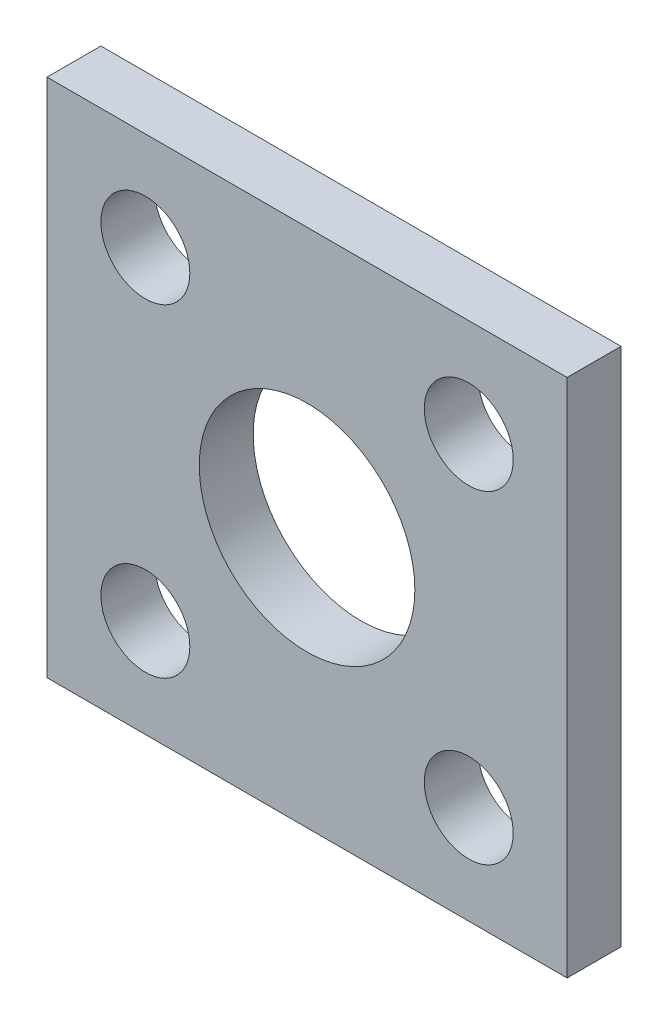
from build123d import *

# Parameters (mm, degrees)
SKETCH1_W           = 48.25
SKETCH1_H           = 48.25
SKETCH1_R           = 10
SKETCH1_R_2         = 4.125
BOSS_EXTRUDE1_DEPTH = 5


with BuildPart() as part:
    # Sketch1 → Boss-Extrude1 (new body)
    # profile 1 of 5: a face of its own
    with BuildSketch(Plane.XY):
        with Locations((24.125, 24.125)):
            Rectangle(SKETCH1_W, SKETCH1_H)
        with Locations((24.125, 24.125)):
            Circle(SKETCH1_R, mode=Mode.SUBTRACT)
        Polygon((34.895909278, 1.8), (30.666818556, 9.125), (34.895909278, 16.45), (43.354090722, 16.45), (47.583181444, 9.125), (43.354090722, 1.8), align=None, mode=Mode.SUBTRACT)
        Polygon((13.354090722, 1.8), (17.583181444, 9.125), (13.354090722, 16.45), (4.895909278, 16.45), (0.666818556, 9.125), (4.895909278, 1.8), align=None, mode=Mode.SUBTRACT)
        Polygon((34.895909278, 31.8), (43.354090722, 31.8), (47.583181444, 39.125), (43.354090722, 46.45), (34.895909278, 46.45), (30.666818556, 39.125), align=None, mode=Mode.SUBTRACT)
        Polygon((17.583181444, 39.125), (13.354090722, 31.8), (4.895909278, 31.8), (0.666818556, 39.125), (4.895909278, 46.45), (13.354090722, 46.45), align=None, mode=Mode.SUBTRACT)
    # profile 2 of 5: a face of its own
    with BuildSketch(Plane.XY):
        Polygon((30.666818556, 39.125), (34.895909278, 31.8), (43.354090722, 31.8), (47.583181444, 39.125), (43.354090722, 46.45), (34.895909278, 46.45), align=None)
        with Locations((39.125, 39.125)):
            Circle(SKETCH1_R_2, mode=Mode.SUBTRACT)
    # profile 3 of 5: a face of its own
    with BuildSketch(Plane.XY):
        Polygon((30.666818556, 9.125), (34.895909278, 16.45), (43.354090722, 16.45), (47.583181444, 9.125), (43.354090722, 1.8), (34.895909278, 1.8), align=None)
        with Locations((39.125, 9.125)):
            Circle(SKETCH1_R_2, mode=Mode.SUBTRACT)
    # profile 4 of 5: a face of its own
    with BuildSketch(Plane.XY):
        Polygon((4.895909278, 1.8), (13.354090722, 1.8), (17.583181444, 9.125), (13.354090722, 16.45), (4.895909278, 16.45), (0.666818556, 9.125), align=None)
        with Locations((9.125, 9.125)):
            Circle(SKETCH1_R_2, mode=Mode.SUBTRACT)
    # profile 5 of 5: a face of its own
    with BuildSketch(Plane.XY):
        Polygon((13.354090722, 31.8), (4.895909278, 31.8), (0.666818556, 39.125), (4.895909278, 46.45), (13.354090722, 46.45), (17.583181444, 39.125), align=None)
        with Locations((9.125, 39.125)):
            Circle(SKETCH1_R_2, mode=Mode.SUBTRACT)
    extrude(amount=BOSS_EXTRUDE1_DEPTH)


solid = part.part
